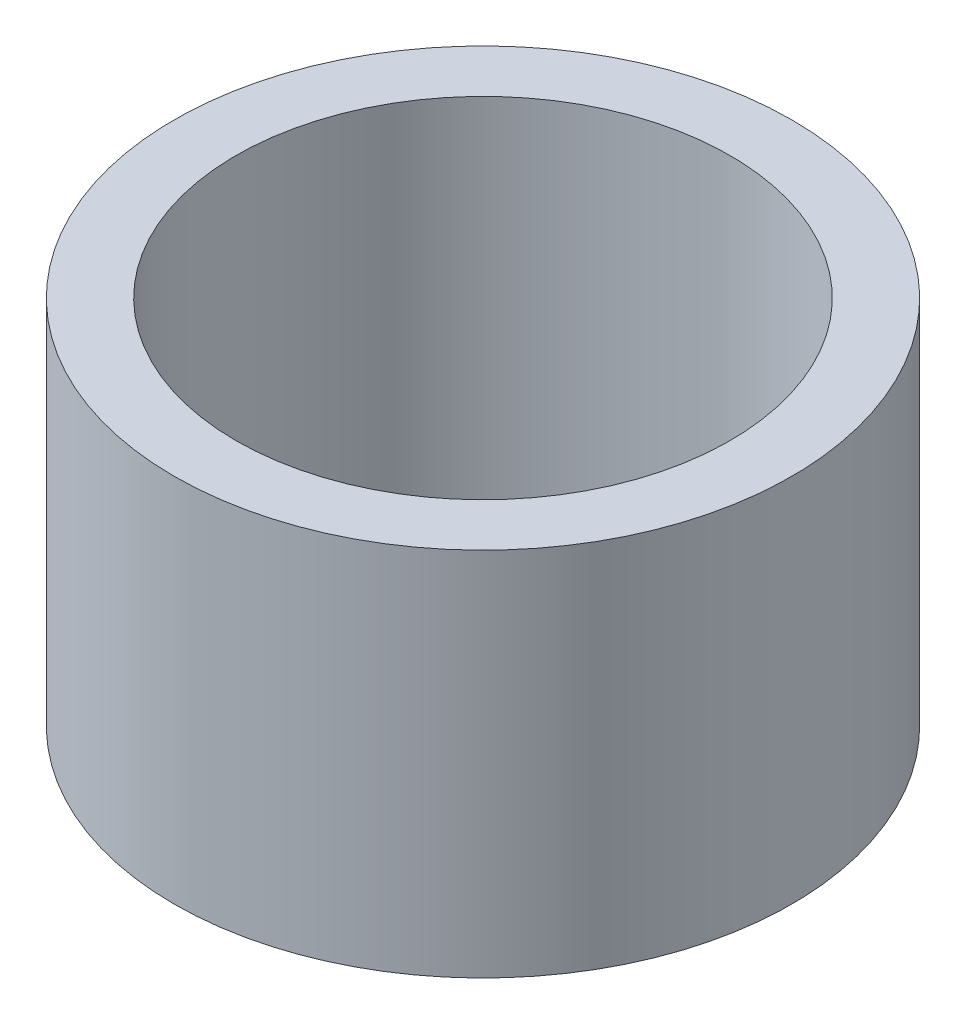
from build123d import *

# Parameters (mm, degrees)
CROQUIS1_R              = 5
CROQUIS1_R_2            = 4
SALIENTE_EXTRUIR1_DEPTH = 6


with BuildPart() as part:
    # Croquis1 → Saliente-Extruir1 (new body)
    with BuildSketch(Plane(origin=(0, 0, 0), x_dir=(1, 0, 0), z_dir=(0, 1, 0))):
        with Locations(Location((0, 0, 0), (0, 0, 270))):
            Circle(CROQUIS1_R)
        with Locations(Location((0, 0, 0), (0, 0, 270))):
            Circle(CROQUIS1_R_2, mode=Mode.SUBTRACT)
    extrude(amount=SALIENTE_EXTRUIR1_DEPTH)


solid = part.part
